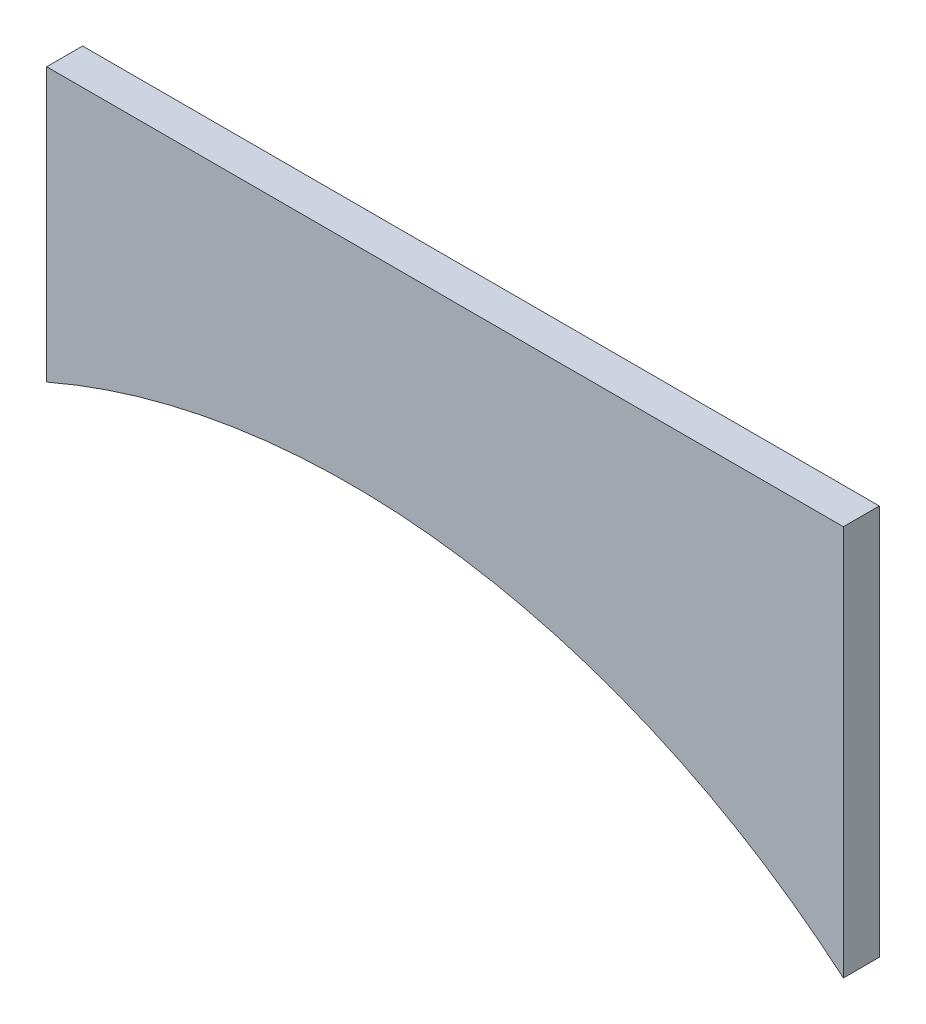
from build123d import *

# Parameters (mm, degrees)
SKETCH1_W           = 66.548
SKETCH1_H           = 45.72
BOSS_EXTRUDE1_DEPTH = 3
SKETCH2_R           = 63.5
CUT_EXTRUDE1_DEPTH  = 81.795759196


with BuildPart() as part:
    # Sketch1 → Boss-Extrude1 (new body)
    with BuildSketch(Plane.XY):
        with Locations((33.274, 22.86)):
            Rectangle(SKETCH1_W, SKETCH1_H)
    extrude(amount=BOSS_EXTRUDE1_DEPTH)

    # Sketch2 → Cut-Extrude1 (cut, through all)
    with BuildSketch(Plane.XY.offset(3)):
        with Locations((25.4, -35.29)):
            Circle(SKETCH2_R)
    extrude(amount=-CUT_EXTRUDE1_DEPTH, mode=Mode.SUBTRACT)


solid = part.part
